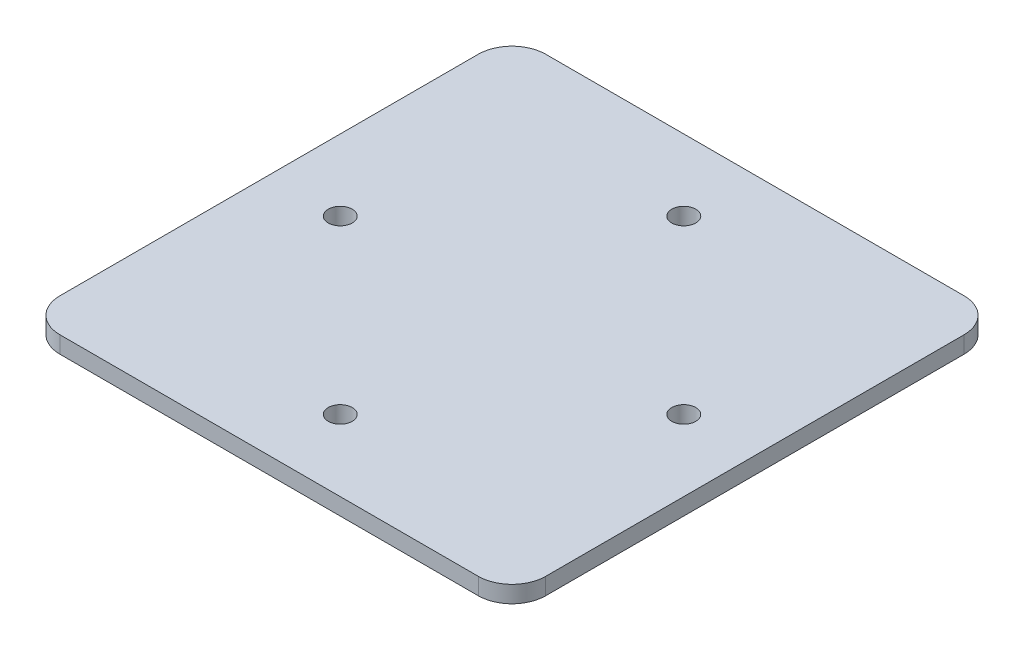
from build123d import *

# Parameters (mm, degrees)
SKETCH1_W           = 45.72
SKETCH1_H           = 45.72
BOSS_EXTRUDE1_DEPTH = 1.5875
FILLET1_R           = 3.175
SKETCH2_R           = 1.1303
CUT_EXTRUDE1_DEPTH  = 65.677329539


with BuildPart() as part:
    # Sketch1 → Boss-Extrude1 (new body)
    with BuildSketch(Plane(origin=(0, 0, 0), x_dir=(1, 0, 0), z_dir=(0, 1, 0))):
        with Locations((22.86, 22.86)):
            Rectangle(SKETCH1_W, SKETCH1_H)
    extrude(amount=BOSS_EXTRUDE1_DEPTH)

    # Fillet1
    fillet1_edges = [part.edges().sort_by_distance(p)[0] for p in [
        (0, 0.79375, -45.72),
        (45.72, 0.79375, -45.72),
        (45.72, 0.79375, 0),
        (0, 0.79375, 0),
    ]]
    fillet(fillet1_edges, radius=FILLET1_R)

    # Sketch2 → Cut-Extrude1 (cut, through all)
    with BuildSketch(Plane(origin=(0, 1.5875, 0), x_dir=(1, 0, 0), z_dir=(0, 1, 0))):
        with Locations(Location((39.024461018, 22.86, 0), (0, 0, 270))):
            Circle(SKETCH2_R)
        with Locations(Location((22.86, 6.695538982, 0), (0, 0, 270))):
            Circle(SKETCH2_R)
        with Locations(Location((6.695538982, 22.86, 0), (0, 0, 270))):
            Circle(SKETCH2_R)
        with Locations(Location((22.86, 39.024461018, 0), (0, 0, 270))):
            Circle(SKETCH2_R)
    extrude(amount=-CUT_EXTRUDE1_DEPTH, mode=Mode.SUBTRACT)


solid = part.part
